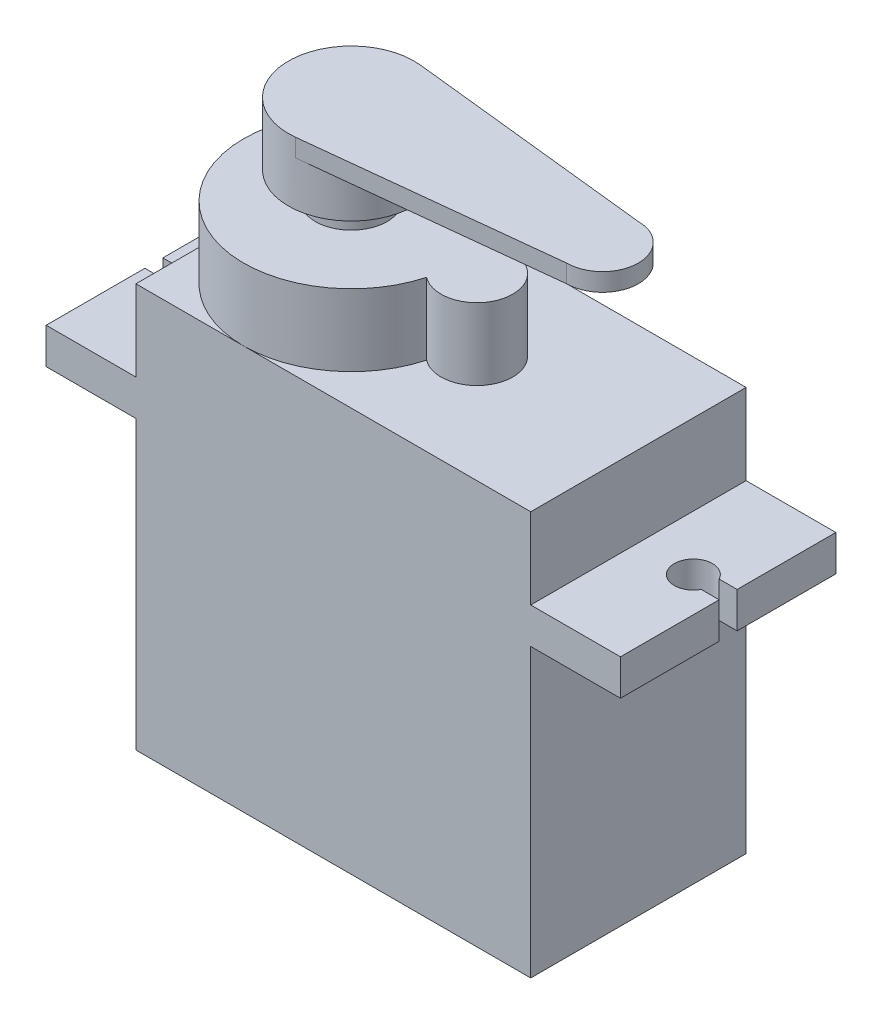
from build123d import *

# Parameters (mm, degrees)
SKETCH1_W           = 22
SKETCH1_H           = 12
BOSS_EXTRUDE1_DEPTH = 22.5
SKETCH2_W           = 12
SKETCH2_H           = 2
BOSS_EXTRUDE2_DEPTH = 5
CUT_EXTRUDE1_REACH  = 26.819
SKETCH4_R           = 6
BOSS_EXTRUDE3_DEPTH = 4
SKETCH5_R           = 2
BOSS_EXTRUDE4_DEPTH = 4
SKETCH6_R           = 2
BOSS_EXTRUDE5_DEPTH = 1.5
SKETCH7_R           = 3.5
BOSS_EXTRUDE6_DEPTH = 3.5
BOSS_EXTRUDE7_DEPTH = 1


with BuildPart() as part:
    # Sketch1 → Boss-Extrude1 (new body)
    with BuildSketch(Plane(origin=(0, 0, 0), x_dir=(1, 0, 0), z_dir=(0, 1, 0))):
        Rectangle(SKETCH1_W, SKETCH1_H)
    extrude(amount=BOSS_EXTRUDE1_DEPTH)

    # Sketch2 → Boss-Extrude2 (add)
    with BuildSketch(Plane.ZY.offset(11)):
        with Locations((0, 17)):
            Rectangle(SKETCH2_W, SKETCH2_H)
    boss_extrude2 = extrude(amount=BOSS_EXTRUDE2_DEPTH)

    # Sketch3 → Cut-Extrude1 (cut, up to next)
    with BuildSketch(Plane(origin=(0, 18, 0), x_dir=(1, 0, 0), z_dir=(0, 1, 0)), mode=Mode.PRIVATE) as cut_extrude1_sk1:
        with BuildLine():
            Line((-16, 0.5), (-16, -0.5))
            Line((-16, -0.5), (-15, -0.5))
            ThreePointArc((-15, -0.5), (-13, 0), (-15, 0.5))
            Line((-15, 0.5), (-16, 0.5))
        make_face()
    cut_extrude1_tool1 = extrude(cut_extrude1_sk1.sketch, amount=-CUT_EXTRUDE1_REACH, mode=Mode.PRIVATE) & part.part
    cut_extrude1 = cut_extrude1_tool1.solids().sort_by_distance((-14.365975, 18, 0))[0]
    add(cut_extrude1, mode=Mode.SUBTRACT)

    # Mirror1: Boss-Extrude2, Cut-Extrude1 across plane
    add(boss_extrude2.mirror(Plane(origin=(0, 0, 0), x_dir=(0, 0, 1), z_dir=(1, 0, 0))))
    add(cut_extrude1.mirror(Plane(origin=(0, 0, 0), x_dir=(0, 0, 1), z_dir=(1, 0, 0))), mode=Mode.SUBTRACT)

    # Sketch4 → Boss-Extrude3 (add)
    with BuildSketch(Plane(origin=(0, 22.5, 0), x_dir=(1, 0, 0), z_dir=(0, 1, 0))):
        with Locations(Location((-5, 0, 0), (0, 0, 270))):
            Circle(SKETCH4_R)
    extrude(amount=BOSS_EXTRUDE3_DEPTH)

    # Sketch5 → Boss-Extrude4 (add)
    with BuildSketch(Plane(origin=(0, 22.5, 0), x_dir=(1, 0, 0), z_dir=(0, 1, 0))):
        with Locations((2, 0)):
            Circle(SKETCH5_R)
    extrude(amount=BOSS_EXTRUDE4_DEPTH)

    # Sketch6 → Boss-Extrude5 (add)
    with BuildSketch(Plane(origin=(0, 26.5, 0), x_dir=(1, 0, 0), z_dir=(0, 1, 0))):
        with Locations(Location((-5, 0, 0), (0, 0, 270))):
            Circle(SKETCH6_R)
    extrude(amount=BOSS_EXTRUDE5_DEPTH)

    # Sketch7 → Boss-Extrude6 (add)
    with BuildSketch(Plane(origin=(0, 28, 0), x_dir=(1, 0, 0), z_dir=(0, 1, 0))):
        with Locations(Location((-5, 0, 0), (0, 0, 270))):
            Circle(SKETCH7_R)
    extrude(amount=BOSS_EXTRUDE6_DEPTH)

    # Sketch8 → Boss-Extrude7 (add)
    with BuildSketch(Plane(origin=(0, 31.5, 0), x_dir=(1, 0, 0), z_dir=(0, 1, 0))):
        with BuildLine():
            Line((-4.622076636, 3.479536453), (-4.622076636, -3.479536453))
            Line((-4.622076636, -3.479536453), (9, -2))
            ThreePointArc((9, -2), (11, 0), (9, 2))
            Line((9, 2), (-4.622076636, 3.479536453))
        make_face()
    extrude(amount=-BOSS_EXTRUDE7_DEPTH)


solid = part.part
